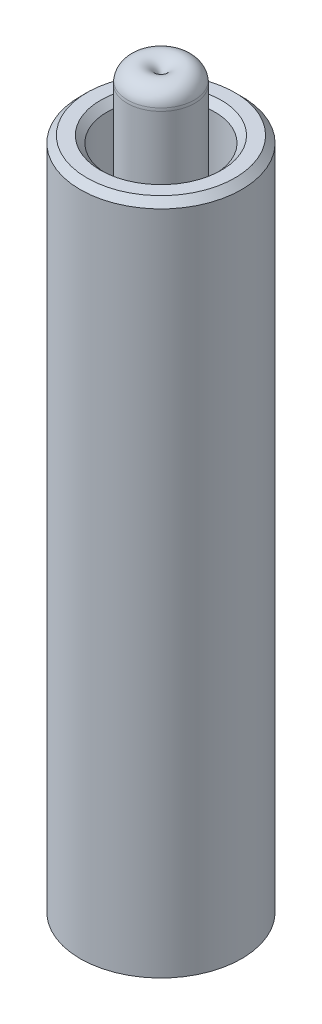
from build123d import *

# Parameters (mm, degrees)
SKETCH_1_R          = 6
EXTRUDE_1_DEPTH     = 50
SKETCH_2_R          = 4
SKETCH_2_R_2        = 2.5
CUT_EXTRUDE_1_DEPTH = 8
EXTRUDE_START       = 5
SKETCH_3_R          = 2.5
EXTRUDE_2_DEPTH     = 5
FILLET_1_R          = 1.7
SKETCH_4_R          = 0.096106959
CUT_EXTRUDE_2_DEPTH = 5
FILLET_2_R          = 1.2
CHAMFER_1_SIZE      = 0.5


with BuildPart() as part:
    # 草图1 → 凸台-拉伸1 (new body)
    with BuildSketch(Plane(origin=(0, 0, 0), x_dir=(1, 0, 0), z_dir=(0, 1, 0))):
        with Locations(Location((0, 0, 0), (0, 0, 270))):
            Circle(SKETCH_1_R)
    extrude(amount=EXTRUDE_1_DEPTH)

    # 草图2 → 切除-拉伸1 (cut)
    with BuildSketch(Plane(origin=(0, 50, 0), x_dir=(1, 0, 0), z_dir=(0, 1, 0))):
        with Locations(Location((0, 0, 0), (0, 0, 270))):
            Circle(SKETCH_2_R)
        with Locations(Location((0, 0, 0), (0, 0, 270))):
            Circle(SKETCH_2_R_2, mode=Mode.SUBTRACT)
    extrude(amount=-CUT_EXTRUDE_1_DEPTH, mode=Mode.SUBTRACT)

    # 草图3 → 凸台-拉伸2 (add)
    with BuildSketch(Plane(origin=(0, 50, 0), x_dir=(1, 0, 0), z_dir=(0, 1, 0)).offset(EXTRUDE_START)):
        with Locations(Location((0, 0, 0), (0, 0, 270))):
            Circle(SKETCH_3_R)
    extrude(amount=-EXTRUDE_2_DEPTH)

    # 圆角1
    fillet_1_edges = [part.edges().sort_by_distance(p)[0] for p in [
        (0, 55, -2.5),
    ]]
    fillet(fillet_1_edges, radius=FILLET_1_R)

    # 草图4 → 切除-拉伸2 (cut)
    with BuildSketch(Plane(origin=(0, 55, 0), x_dir=(1, 0, 0), z_dir=(0, 1, 0))):
        with Locations(Location((0, 0, 0), (0, 0, 270))):
            Circle(SKETCH_4_R)
    extrude(amount=-CUT_EXTRUDE_2_DEPTH, mode=Mode.SUBTRACT)

    # 圆角2
    fillet_2_edges = [part.edges().sort_by_distance(p)[0] for p in [
        (0, 55, -0.096106959),
    ]]
    fillet(fillet_2_edges, radius=FILLET_2_R)

    # 倒角1
    chamfer_1_edges = [part.edges().sort_by_distance(p)[0] for p in [
        (0, 50, -6),
        (0, 50, -4),
    ]]
    chamfer(chamfer_1_edges, length=CHAMFER_1_SIZE)


solid = part.part
